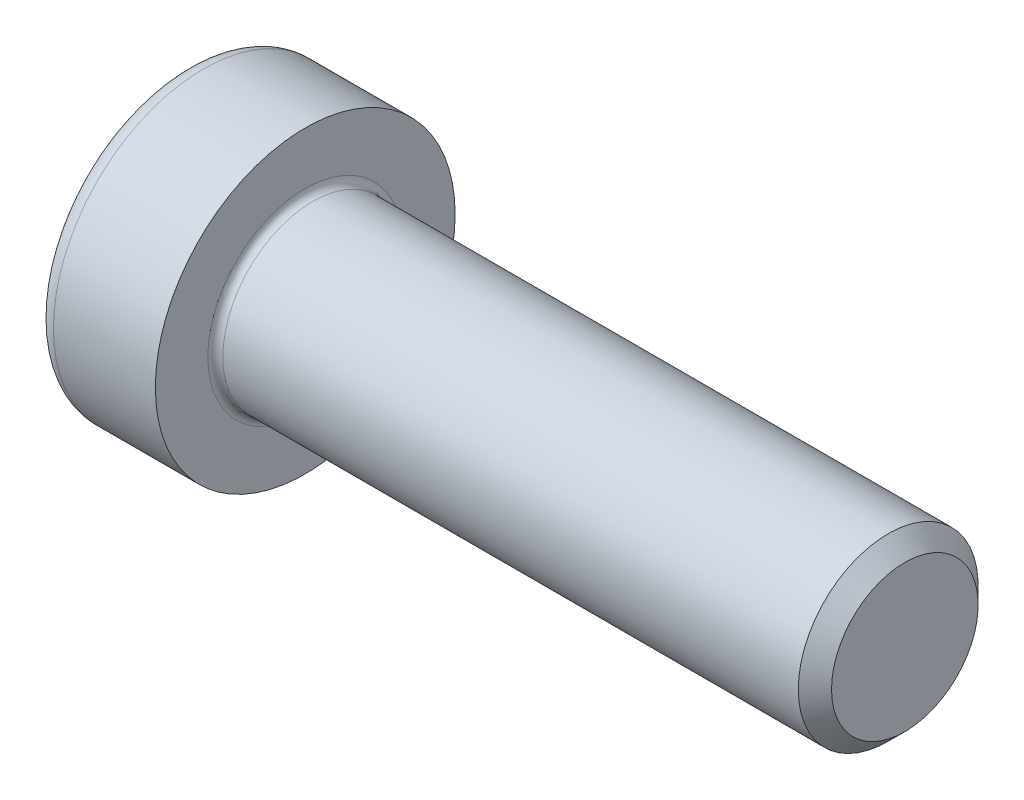
from build123d import *

# Parameters (mm, degrees)
FILLET1_R   = 0.25
FILLET2_R   = 0.6
HEX_2_DEPTH = 3


with BuildPart() as part:
    # BodySke → Base-Revolve (revolve)
    with BuildSketch(Plane.XY, mode=Mode.PRIVATE) as base_revolve_sk:
        Polygon((0, 0), (0, 5), (4, 5), (4, 3), (23.4455, 3), (24, 2.4455), (24, 0), align=None)
    revolve(base_revolve_sk.sketch.rotate(Axis((-31.75, 0, 0), (1, 0, 0)), 90), axis=Axis((-31.75, 0, 0), (1, 0, 0)))

    # Fillet1
    fillet1_edges = [part.edges().sort_by_distance(p)[0] for p in [
        (4, 0, -3),
    ]]
    fillet(fillet1_edges, radius=FILLET1_R)

    # Fillet2
    fillet2_edges = [part.edges().sort_by_distance(p)[0] for p in [
        (0, 0, -5),
    ]]
    fillet(fillet2_edges, radius=FILLET2_R)

    # Sketch2 → Hex-PreBroach (revolve, cut)
    with BuildSketch(Plane.XY, mode=Mode.PRIVATE) as hex_prebroach_sk:
        Polygon((0, 2), (3, 2), (4.154700538, 0), (0, 0), align=None)
    revolve(hex_prebroach_sk.sketch.rotate(Axis((0, 0, 0), (1, 0, 0)), 90), axis=Axis((0, 0, 0), (1, 0, 0)), mode=Mode.SUBTRACT)

    # Sketch3 → Hex 2 (cut)
    with BuildSketch(Plane(origin=(0, 0, 0), x_dir=(0, 0.500000000000001, 0.866025403784438), z_dir=(-1, 0, 0))):
        Polygon((1.154700538, 2), (-1.154700538, 2), (-2.309401077, 0), (-1.154700538, -2), (1.154700538, -2), (2.309401077, 0), align=None)
    extrude(amount=-HEX_2_DEPTH, mode=Mode.SUBTRACT)


solid = part.part
